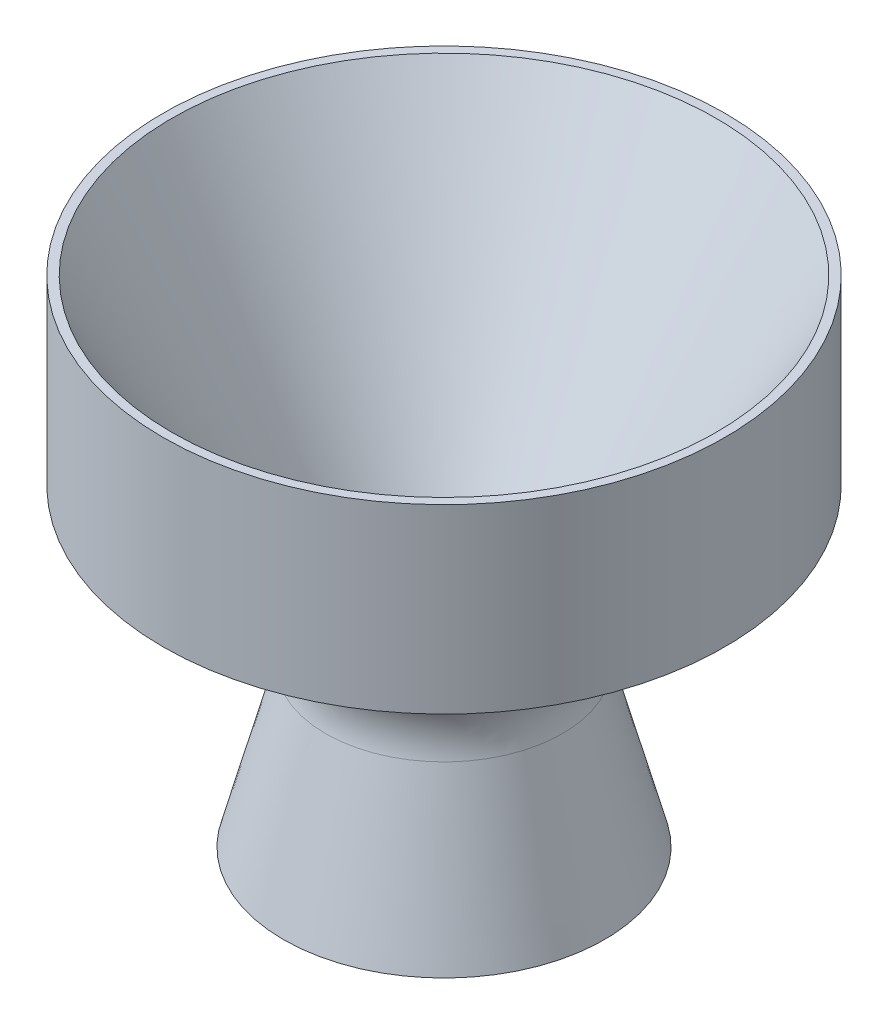
from build123d import *

# Parameters (mm, degrees)
FILLET1_R = 10


with BuildPart() as part:
    # Sketch1 → Revolve1 (revolve)
    with BuildSketch(Plane.XY, mode=Mode.PRIVATE) as revolve1_sk:
        Polygon((37.5, 42.257268448), (13.285767388, 0.316987298), (13.285767388, -0.683012702), (20.059447639, -25.962731552), (22.13, -25.962731552), (15.249019056, -0.282561065), (25.375644347, 17.257268448), (38.71, 17.257268448), (38.71, 42.257268448), align=None)
    revolve(revolve1_sk.sketch.rotate(Axis((0, 0, 0), (0, -1, 0)), 90), axis=Axis((0, 0, 0), (0, -1, 0)))

    # Fillet1
    fillet1_edges = [part.edges().sort_by_distance(p)[0] for p in [
        (0, 17.257268448, -25.375644347),
        (0, -0.282561065, -15.249019056),
    ]]
    fillet(fillet1_edges, radius=FILLET1_R)


solid = part.part
